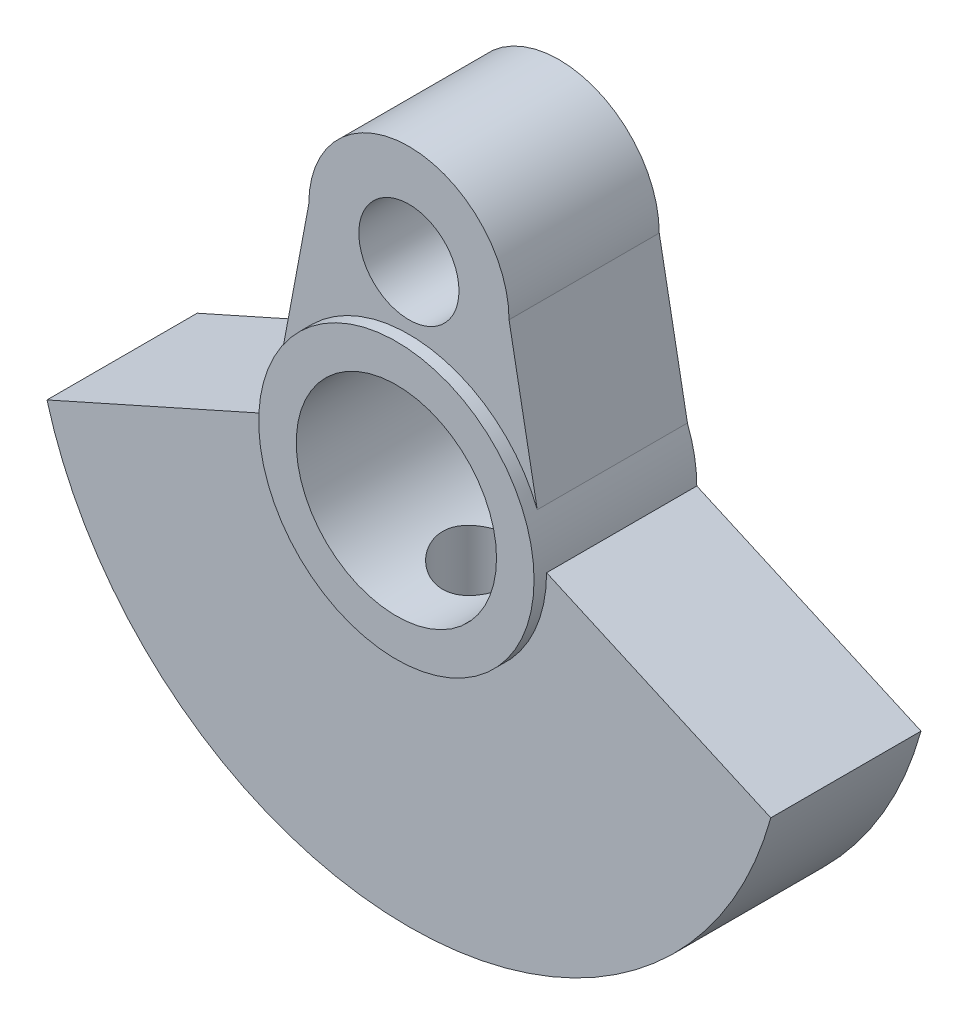
from build123d import *

# Parameters (mm, degrees)
SKETCH1_R             = 2
BOSS_EXTRUDE1_DEPTH   = 6
BOSS_EXTRUDE1_2_DEPTH = 6
SKETCH2_R             = 5.5
SKETCH2_R_2           = 4
BOSS_EXTRUDE2_DEPTH   = 6.5


with BuildPart() as part:
    # Sketch1 → Boss-Extrude1 (new body)
    with BuildSketch(Plane.XY):
        with BuildLine():
            Line((-4, 8), (-5.126415094, 1.99245283))
            ThreePointArc((-5.126415094, 1.99245283), (0, 5.5), (5.126415094, 1.99245283))
            Line((5.126415094, 1.99245283), (4, 8))
            ThreePointArc((4, 8), (0, 12), (-4, 8))
        make_face()
        with Locations((0, 8)):
            Circle(SKETCH1_R, mode=Mode.SUBTRACT)
    extrude(amount=BOSS_EXTRUDE1_DEPTH)



with BuildPart() as body_2:
    # Sketch1 → Boss-Extrude1 2 (new body)
    with BuildSketch(Plane.XY):
        with BuildLine():
            Line((-5.5, 0), (-14.456832295, -4))
            ThreePointArc((-14.456832295, -4), (0, -15), (14.456832295, -4))
            Line((14.456832295, -4), (5.5, 0))
            ThreePointArc((5.5, 0), (0, -5.5), (-5.5, 0))
        make_face()
    extrude(amount=BOSS_EXTRUDE1_2_DEPTH)


with BuildPart() as part_1:
    add(part.part)

    add(body_2.part)  # Boss-Extrude2 merges body 2
    # Sketch2 → Boss-Extrude2 (add)
    with BuildSketch(Plane.XY):
        Circle(SKETCH2_R)
        with Locations(Location((0, 0, 0), (0, 0, 180))):
            Circle(SKETCH2_R_2, mode=Mode.SUBTRACT)
    extrude(amount=BOSS_EXTRUDE2_DEPTH)

    # Sketch4 → M4 Tapped Hole1 (revolve, cut)
    with BuildSketch(Plane(origin=(0, 0, 3), x_dir=(0, 0, 1), z_dir=(1, 0, 0))):
        Polygon((0, 0), (0, 21.091420021), (1.65, 20.1), (1.65, 0), align=None)
    revolve(axis=Axis((0, 6.35, 3), (0, -1, 0)), mode=Mode.SUBTRACT)


solid = part_1.part
